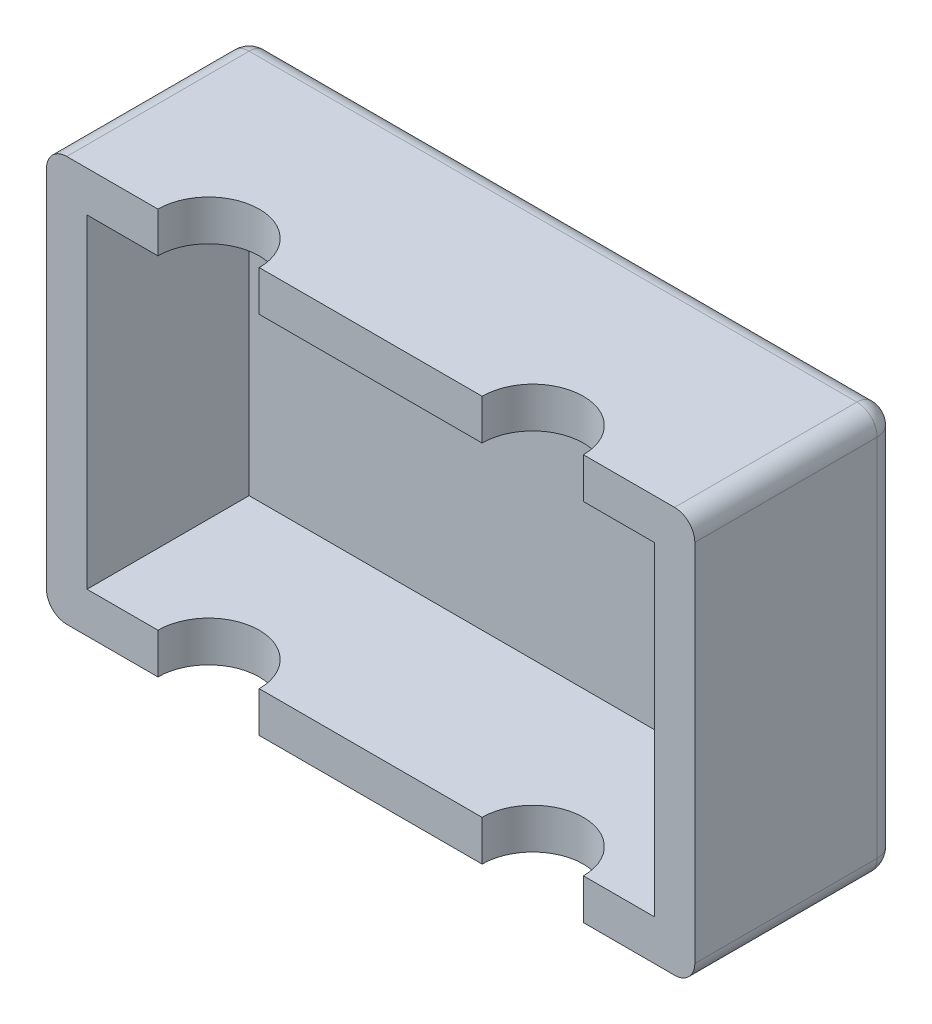
from build123d import *

# Parameters (mm, degrees)
BOSS_EXTRUDE1_DEPTH     = 20
FILLET1_R               = 2
SHELL1_T                = -4
CUT_EXTRUDE1_DEPTH      = 43.708313008
CUT_EXTRUDE1_DEPTH_BACK = 43.708313008
SKETCH2_R               = 5


with BuildPart() as part:
    # Sketch1 → Boss-Extrude1 (new body)
    with BuildSketch(Plane.XY):
        with BuildLine():
            Line((-30, 20), (30, 20))
            ThreePointArc((30, 20), (31.414213562, 19.414213562), (32, 18))
            Line((32, 18), (32, -18))
            ThreePointArc((32, -18), (31.414213562, -19.414213562), (30, -20))
            Line((30, -20), (-30, -20))
            ThreePointArc((-30, -20), (-31.414213562, -19.414213562), (-32, -18))
            Line((-32, -18), (-32, 18))
            ThreePointArc((-32, 18), (-31.414213562, 19.414213562), (-30, 20))
        make_face()
    extrude(amount=BOSS_EXTRUDE1_DEPTH)

    # Fillet1
    fillet1_edges = [part.edges().sort_by_distance(p)[0] for p in [
        (0, -20, 0),
        (-31.414213562, -19.414213562, 0),
        (-32, 0, 0),
        (-31.414213562, 19.414213562, 0),
        (0, 20, 0),
        (31.414213562, 19.414213562, 0),
        (32, 0, 0),
        (31.414213562, -19.414213562, 0),
    ]]
    fillet(fillet1_edges, radius=FILLET1_R)

    # Shell1
    shell1_openings = [part.faces().sort_by_distance(p)[0] for p in [
        (0, 0, 20),
    ]]
    offset(amount=SHELL1_T, openings=shell1_openings, kind=Kind.INTERSECTION)

    # Sketch2 → Cut-Extrude1 (cut, two sides: drawn at the far end of the back side and taken through both)
    with BuildSketch(Plane(origin=(0, 0, 0), x_dir=(1, 0, 0), z_dir=(0, 1, 0)).offset(-CUT_EXTRUDE1_DEPTH_BACK)):
        with Locations((-16, -20)):
            Circle(SKETCH2_R)
        with Locations((16, -20)):
            Circle(SKETCH2_R)
    extrude(amount=CUT_EXTRUDE1_DEPTH + CUT_EXTRUDE1_DEPTH_BACK, mode=Mode.SUBTRACT)


solid = part.part
